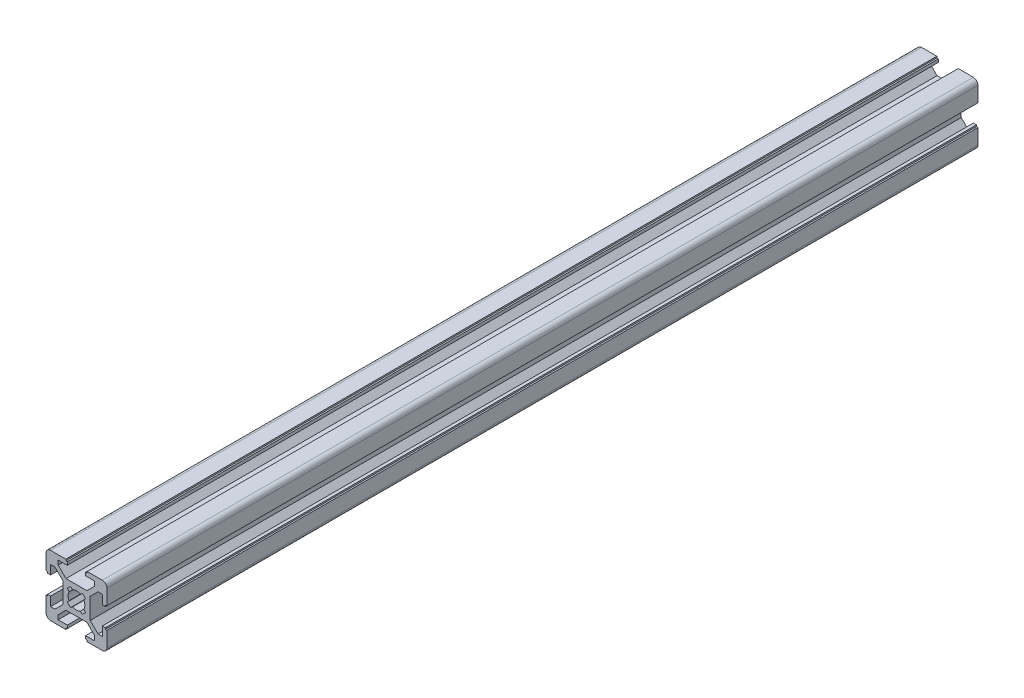
from build123d import *

# Parameters (mm, degrees)
AUFSATZ_LINEAR_AUSTRAGEN1_DEPTH = 286


with BuildPart() as part:
    # Skizze1 → Aufsatz-Linear austragen1 (new body)
    with BuildSketch(Plane.XY):
        with BuildLine():
            Line((9.896623228, -8.686160957), (9.896623228, -3.686160957))
            Line((9.896623228, -3.686160957), (9.396623228, -3.686160957))
            Line((9.396623228, -3.686160957), (9.396623228, -3.186160957))
            Line((9.396623228, -3.186160957), (8.396623228, -3.186160957))
            Line((8.396623228, -3.186160957), (8.396623228, -6.186160957))
            Line((8.396623228, -6.186160957), (6.957283398, -6.186160957))
            Line((6.957283398, -6.186160957), (4.396623228, -3.625500787))
            Line((4.396623228, -3.625500787), (4.396623228, 3.253178873))
            Line((4.396623228, 3.253178873), (6.957283398, 5.813839043))
            Line((6.957283398, 5.813839043), (8.396623228, 5.813839043))
            Line((8.396623228, 5.813839043), (8.396623228, 2.813839043))
            Line((8.396623228, 2.813839043), (9.396623228, 2.813839043))
            Line((9.396623228, 2.813839043), (9.396623228, 3.313839043))
            Line((9.396623228, 3.313839043), (9.896623228, 3.313839043))
            Line((9.896623228, 3.313839043), (9.896623228, 8.313839043))
            ThreePointArc((9.896623228, 8.313839043), (9.457283398, 9.374499213), (8.396623228, 9.813839043))
            Line((8.396623228, 9.813839043), (3.396623228, 9.813839043))
            Line((3.396623228, 9.813839043), (3.396623228, 9.313839043))
            Line((3.396623228, 9.313839043), (2.896623228, 9.313839043))
            Line((2.896623228, 9.313839043), (2.896623228, 8.313839043))
            Line((2.896623228, 8.313839043), (5.896623228, 8.313839043))
            Line((5.896623228, 8.313839043), (5.896623228, 6.874499213))
            Line((5.896623228, 6.874499213), (3.335963058, 4.313839043))
            Line((3.335963058, 4.313839043), (-3.542716602, 4.313839043))
            Line((-3.542716602, 4.313839043), (-6.103376772, 6.874499213))
            Line((-6.103376772, 6.874499213), (-6.103376772, 8.313839043))
            Line((-6.103376772, 8.313839043), (-3.103376772, 8.313839043))
            Line((-3.103376772, 8.313839043), (-3.103376772, 9.313839043))
            Line((-3.103376772, 9.313839043), (-3.603376772, 9.313839043))
            Line((-3.603376772, 9.313839043), (-3.603376772, 9.813839043))
            Line((-3.603376772, 9.813839043), (-8.603376772, 9.813839043))
            ThreePointArc((-8.603376772, 9.813839043), (-9.664036942, 9.374499213), (-10.103376772, 8.313839043))
            Line((-10.103376772, 8.313839043), (-10.103376772, 3.313839043))
            Line((-10.103376772, 3.313839043), (-9.603376772, 3.313839043))
            Line((-9.603376772, 3.313839043), (-9.603376772, 2.813839043))
            Line((-9.603376772, 2.813839043), (-8.603376772, 2.813839043))
            Line((-8.603376772, 2.813839043), (-8.603376772, 5.813839043))
            Line((-8.603376772, 5.813839043), (-7.164036942, 5.813839043))
            Line((-7.164036942, 5.813839043), (-4.603376772, 3.253178873))
            Line((-4.603376772, 3.253178873), (-4.603376772, -3.625500787))
            Line((-4.603376772, -3.625500787), (-7.164036942, -6.186160957))
            Line((-7.164036942, -6.186160957), (-8.603376772, -6.186160957))
            Line((-8.603376772, -6.186160957), (-8.603376772, -3.186160957))
            Line((-8.603376772, -3.186160957), (-9.603376772, -3.186160957))
            Line((-9.603376772, -3.186160957), (-9.603376772, -3.686160957))
            Line((-9.603376772, -3.686160957), (-10.103376772, -3.686160957))
            Line((-10.103376772, -3.686160957), (-10.103376772, -8.686160957))
            ThreePointArc((-10.103376772, -8.686160957), (-9.664036942, -9.746821127), (-8.603376772, -10.186160957))
            Line((-8.603376772, -10.186160957), (-3.603376772, -10.186160957))
            Line((-3.603376772, -10.186160957), (-3.603376772, -9.686160957))
            Line((-3.603376772, -9.686160957), (-3.103376772, -9.686160957))
            Line((-3.103376772, -9.686160957), (-3.103376772, -8.686160957))
            Line((-3.103376772, -8.686160957), (-6.103376772, -8.686160957))
            Line((-6.103376772, -8.686160957), (-6.103376772, -7.246821127))
            Line((-6.103376772, -7.246821127), (-3.542716602, -4.686160957))
            Line((-3.542716602, -4.686160957), (3.335963058, -4.686160957))
            Line((3.335963058, -4.686160957), (5.896623228, -7.246821127))
            Line((5.896623228, -7.246821127), (5.896623228, -8.686160957))
            Line((5.896623228, -8.686160957), (2.896623228, -8.686160957))
            Line((2.896623228, -8.686160957), (2.896623228, -9.686160957))
            Line((2.896623228, -9.686160957), (3.396623228, -9.686160957))
            Line((3.396623228, -9.686160957), (3.396623228, -10.186160957))
            Line((3.396623228, -10.186160957), (8.396623228, -10.186160957))
            ThreePointArc((8.396623228, -10.186160957), (9.457283398, -9.746821127), (9.896623228, -8.686160957))
        make_face()
        with BuildLine():
            Line((-2.539013132, 1.090622313), (-3.103550972, 1.763412313))
            Line((-3.103550972, 1.763412313), (-2.052950042, 2.814013243))
            Line((-2.052950042, 2.814013243), (-1.380160042, 2.249475403))
            ThreePointArc((-1.380160042, 2.249475403), (-0.103376772, 2.563839041), (1.173406498, 2.249475399))
            Line((1.173406498, 2.249475399), (1.846196498, 2.814013239))
            Line((1.846196498, 2.814013239), (2.896797428, 1.763412309))
            Line((2.896797428, 1.763412309), (2.332259586, 1.09062231))
            ThreePointArc((2.332259586, 1.09062231), (2.646623225, -0.186160958), (2.332259587, -1.462944226))
            Line((2.332259587, -1.462944226), (2.896797427, -2.135734226))
            Line((2.896797427, -2.135734226), (1.846196497, -3.186335156))
            Line((1.846196497, -3.186335156), (1.173406497, -2.621797316))
            ThreePointArc((1.173406497, -2.621797316), (-0.103376773, -2.936160957), (-1.380160043, -2.62179732))
            Line((-1.380160043, -2.62179732), (-2.052950043, -3.18633516))
            Line((-2.052950043, -3.18633516), (-3.103550973, -2.13573423))
            Line((-3.103550973, -2.13573423), (-2.539013133, -1.46294423))
            ThreePointArc((-2.539013133, -1.46294423), (-2.853376773, -0.186160958), (-2.539013132, 1.090622313))
        make_face(mode=Mode.SUBTRACT)
    extrude(amount=AUFSATZ_LINEAR_AUSTRAGEN1_DEPTH)


solid = part.part
